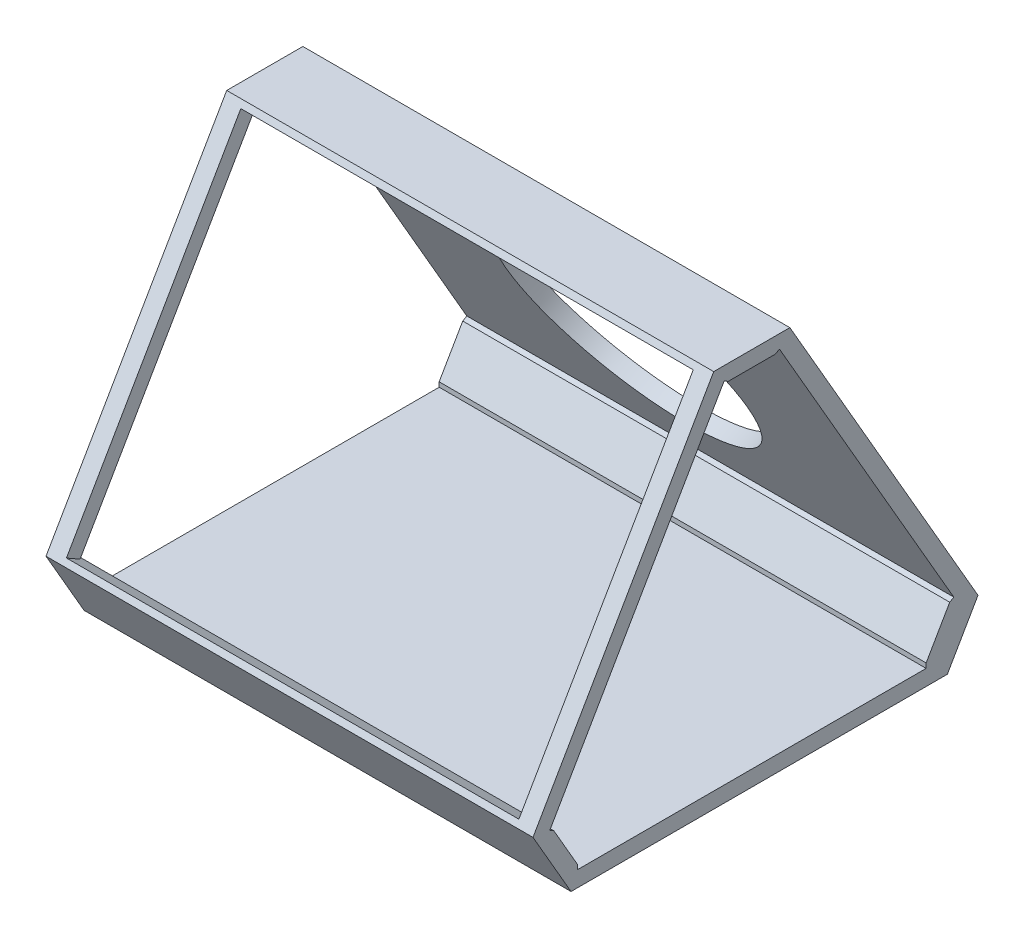
from build123d import *

# Parameters (mm, degrees)
BOSS_EXTRUDE1_DEPTH = 155
SKETCH4_W           = 144
SKETCH4_H           = 111
CUT_EXTRUDE1_DEPTH  = 5
SKETCH5_R           = 38.5
CUT_EXTRUDE2_DEPTH  = 10


with BuildPart() as part:
    # Sketch3 → Boss-Extrude1 (new body)
    with BuildSketch(Plane(origin=(0, 0, 0), x_dir=(0, 0, -1), z_dir=(1, 0, 0))):
        Polygon((58.381197846, 114.119200877), (0.860471904, 14.490381057), (12.979274058, -6.5), (132.75, -6.5), (142.504165125, 10.394709581), (82.618802154, 114.119200877), align=None)
        Polygon((7.5, 12.990381057), (15, 0), (15, -1.5), (126, -1.5), (126, 0), (133.5, 12.990381057), (134.799038106, 13.740381057), (79.299038106, 109.869200877), (78, 109.119200877), (63, 109.119200877), (61.700961894, 109.869200877), (6.200961894, 13.740381057), align=None, mode=Mode.SUBTRACT)
    extrude(amount=BOSS_EXTRUDE1_DEPTH)

    # Sketch4 → Cut-Extrude1 (cut)
    with BuildSketch(Plane(origin=(0, 3.25, 5.629165125), x_dir=(1, 0, 0), z_dir=(0, 0.4999999999999995, 0.8660254037844389))):
        with Locations((77.5, 70.5)):
            Rectangle(SKETCH4_W, SKETCH4_H)
    extrude(amount=-CUT_EXTRUDE1_DEPTH, mode=Mode.SUBTRACT)

    # Sketch5 → Cut-Extrude2 (cut)
    with BuildSketch(Plane(origin=(0, 64.304790967, -111.379165125), x_dir=(-1, 0, 0), z_dir=(0, 0.5000000000000006, -0.8660254037844385))):
        with Locations(Location((-77.5, -2.364637029, 0), (0, 0, 90))):
            Circle(SKETCH5_R)
    extrude(amount=-CUT_EXTRUDE2_DEPTH, mode=Mode.SUBTRACT)


solid = part.part
